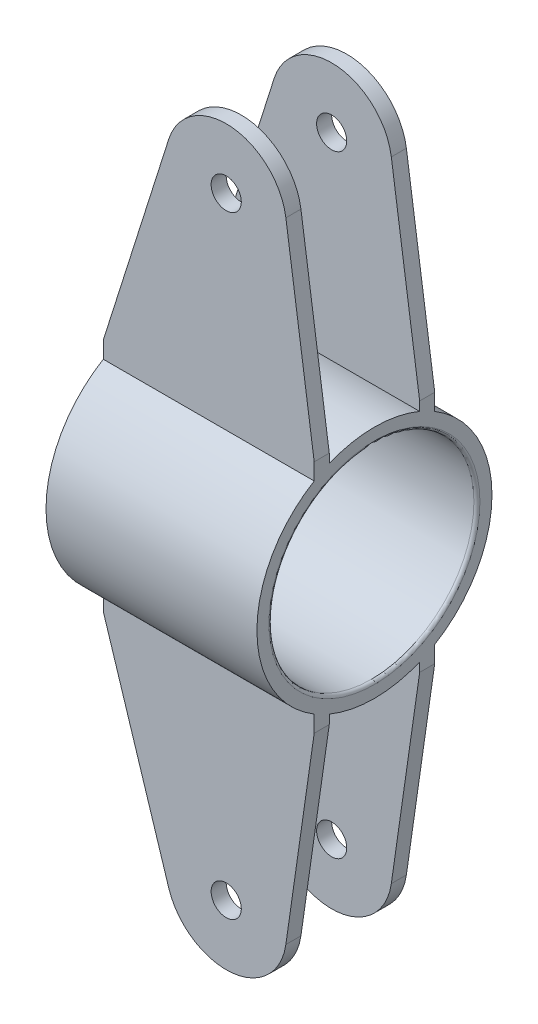
from build123d import *

# Parameters (mm, degrees)
SKETCH1_R             = 39.007
SKETCH1_R_2           = 34.007
BOSS_EXTRUDE1_DEPTH   = 35
BOSS_EXTRUDE2_START   = 15
SKETCH2_R             = 5.007
BOSS_EXTRUDE2_DEPTH   = 5
BOSS_EXTRUDE2_2_DEPTH = 5
BOSS_EXTRUDE3_START   = -15
SKETCH3_R             = 5.007
BOSS_EXTRUDE3_DEPTH   = 5
BOSS_EXTRUDE3_2_DEPTH = 5
BOSS_EXTRUDE4_DEPTH   = 70
BOSS_EXTRUDE6_START   = -4
SKETCH6_R             = 3
BOSS_EXTRUDE6_DEPTH   = 4
FILLET1_R             = 1
FILLET2_R             = 1


with BuildPart() as part:
    # Sketch1 → Boss-Extrude1 (new, symmetric)
    with BuildSketch(Plane(origin=(0, 0, 0), x_dir=(0, 0, -1), z_dir=(1, 0, 0))):
        Circle(SKETCH1_R)
        Circle(SKETCH1_R_2, mode=Mode.SUBTRACT)
    extrude(amount=BOSS_EXTRUDE1_DEPTH, both=True)



with BuildPart() as body_2:
    # Sketch2 → Boss-Extrude2 (new body)
    with BuildSketch(Plane.XY.offset(BOSS_EXTRUDE2_START)):
        with BuildLine():
            Line((-35, -39.007), (35, -39.007))
            Line((35, -39.007), (25.596649495, -104.444761639))
            ThreePointArc((25.596649495, -104.444761639), (7.437713907, -121.532834549), (-13.266839867, -107.637848746))
            Line((-13.266839867, -107.637848746), (-35, -39.007))
        make_face()
        with Locations((5.8, -101.6)):
            Circle(SKETCH2_R, mode=Mode.SUBTRACT)
    extrude(amount=BOSS_EXTRUDE2_DEPTH)


with BuildPart() as body_3:
    # Sketch2 → Boss-Extrude2 2 (new body)
    with BuildSketch(Plane.XY.offset(BOSS_EXTRUDE2_START)):
        with BuildLine():
            Line((35, 39.007), (-35, 39.007))
            Line((-35, 39.007), (-13.266839867, 107.637848746))
            ThreePointArc((-13.266839867, 107.637848746), (7.437713907, 121.532834549), (25.596649495, 104.444761639))
            Line((25.596649495, 104.444761639), (35, 39.007))
        make_face()
        with Locations((5.8, 101.6)):
            Circle(SKETCH2_R, mode=Mode.SUBTRACT)
    extrude(amount=BOSS_EXTRUDE2_2_DEPTH)


with BuildPart() as body_4:
    # Sketch3 → Boss-Extrude3 (new body)
    with BuildSketch(Plane.XY.offset(BOSS_EXTRUDE3_START)):
        with BuildLine():
            Line((-35, -39.007), (-13.266839867, -107.637848746))
            ThreePointArc((-13.266839867, -107.637848746), (7.437713907, -121.532834549), (25.596649495, -104.444761639))
            Line((25.596649495, -104.444761639), (35, -39.007))
            Line((35, -39.007), (-35, -39.007))
        make_face()
        with Locations((5.8, -101.6)):
            Circle(SKETCH3_R, mode=Mode.SUBTRACT)
    extrude(amount=-BOSS_EXTRUDE3_DEPTH)


with BuildPart() as body_5:
    # Sketch3 → Boss-Extrude3 2 (new body)
    with BuildSketch(Plane.XY.offset(BOSS_EXTRUDE3_START)):
        with BuildLine():
            Line((-35, 39.007), (35, 39.007))
            Line((35, 39.007), (25.596649495, 104.444761639))
            ThreePointArc((25.596649495, 104.444761639), (7.437713907, 121.532834549), (-13.266839867, 107.637848746))
            Line((-13.266839867, 107.637848746), (-35, 39.007))
        make_face()
        with Locations((5.8, 101.6)):
            Circle(SKETCH3_R, mode=Mode.SUBTRACT)
    extrude(amount=-BOSS_EXTRUDE3_2_DEPTH)


with BuildPart() as part_1:
    add(part.part)

    add(body_2.part)  # Boss-Extrude4 merges body 2

    add(body_3.part)  # Boss-Extrude4 merges body 3

    add(body_4.part)  # Boss-Extrude4 merges body 4

    add(body_5.part)  # Boss-Extrude4 merges body 5
    # Sketch4 → Boss-Extrude4 (add)
    with BuildSketch(Plane(origin=(35, 0, 0), x_dir=(0, 0, -1), z_dir=(1, 0, 0))):
        with BuildLine():
            Line((20, -39.007), (15, -39.007))
            Line((15, -39.007), (15, -36.007583215))
            ThreePointArc((15, -36.007583215), (17.545232866, -34.838353186), (20, -33.489491621))
            Line((20, -33.489491621), (20, -39.007))
        make_face()
        with BuildLine():
            Line((-20, -39.007), (-15, -39.007))
            Line((-15, -39.007), (-15, -36.007583215))
            ThreePointArc((-15, -36.007583215), (-17.545232866, -34.838353186), (-20, -33.489491621))
            Line((-20, -33.489491621), (-20, -39.007))
        make_face()
        with BuildLine():
            Line((-20, 39.007), (-15, 39.007))
            Line((-15, 39.007), (-15, 36.007583215))
            ThreePointArc((-15, 36.007583215), (-17.545232866, 34.838353186), (-20, 33.489491621))
            Line((-20, 33.489491621), (-20, 39.007))
        make_face()
        with BuildLine():
            Line((20, 39.007), (15, 39.007))
            Line((15, 39.007), (15, 36.007583215))
            ThreePointArc((15, 36.007583215), (17.545232866, 34.838353186), (20, 33.489491621))
            Line((20, 33.489491621), (20, 39.007))
        make_face()
    extrude(amount=-BOSS_EXTRUDE4_DEPTH)

    # Sketch6 → Boss-Extrude6 (add)
    with BuildSketch(Plane.ZY.offset(25.9).offset(BOSS_EXTRUDE6_START)):
        with BuildLine():
            Line((-20, 33.489491621), (-50.098811723, 58.375353815))
            ThreePointArc((-50.098811723, 58.375353815), (-62.911300808, 58.318387785), (-65.151054806, 45.703054903))
            Line((-65.151054806, 45.703054903), (-39.007, 0))
            ThreePointArc((-39.007, 0), (-33.924077357, 19.253649641), (-20, 33.489491621))
        make_face()
        with Locations((-56.470917013, 50.668455984)):
            Circle(SKETCH6_R, mode=Mode.SUBTRACT)
    extrude(amount=BOSS_EXTRUDE6_DEPTH)

    # Fillet1
    fillet1_edges = [part_1.edges().sort_by_distance(p)[0] for p in [
        (35, 0, 34.007),
    ]]
    fillet(fillet1_edges, radius=FILLET1_R)

    # Fillet2
    fillet2_edges = [part_1.edges().sort_by_distance(p)[0] for p in [
        (-35, 0, 34.007),
    ]]
    fillet(fillet2_edges, radius=FILLET2_R)


solid = part_1.part
